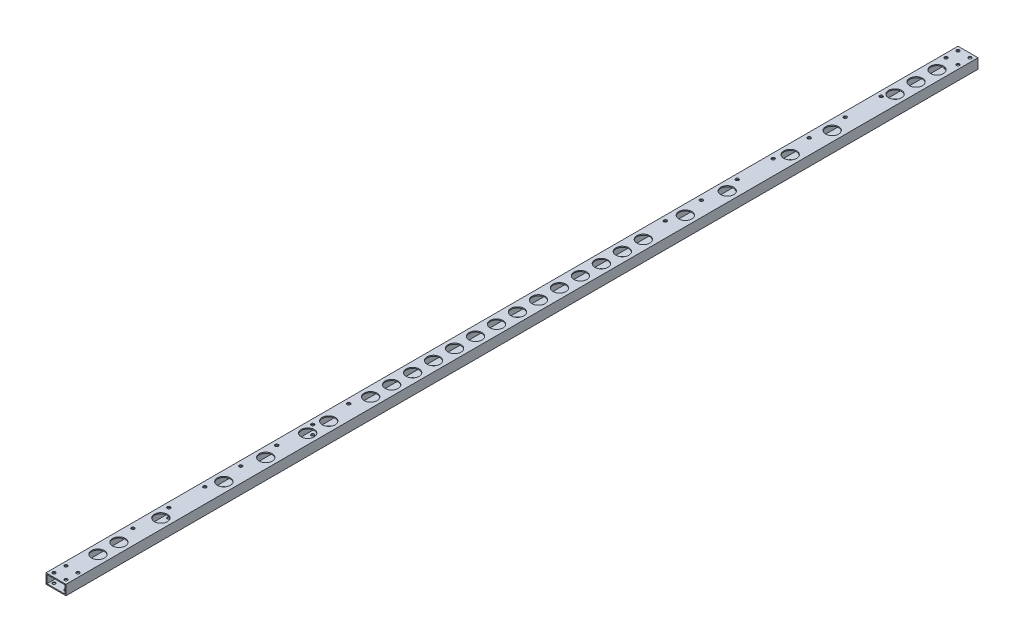
from build123d import *

# Parameters (mm, degrees)
SKETCH_1_W          = 20
SKETCH_1_H          = 10
SKETCH_1_W_2        = 18
SKETCH_1_H_2        = 8
EXTRUDE_1_DEPTH     = 913
SKETCH_2_R          = 1.6
CUT_EXTRUDE_1_DEPTH = 914.273781514
SKETCH_3_R          = 6.5
CUT_EXTRUDE_2_DEPTH = 914.273781514
SKETCH_4_R          = 1.575
CUT_EXTRUDE_3_DEPTH = 914.273781514


with BuildPart() as part:
    # 草图1 → 凸台-拉伸1 (new body)
    with BuildSketch(Plane.XY):
        with Locations((10, 5)):
            Rectangle(SKETCH_1_W, SKETCH_1_H)
        with Locations((10, 5)):
            Rectangle(SKETCH_1_W_2, SKETCH_1_H_2, mode=Mode.SUBTRACT)
    extrude(amount=EXTRUDE_1_DEPTH)

    # 草图2 → 切除-拉伸1 (cut, through all)
    with BuildSketch(Plane.XZ):
        with Locations(Location((5, 759, 0), (0, 0, 270))):
            Circle(SKETCH_2_R)
        with Locations(Location((5, 795, 0), (0, 0, 270))):
            Circle(SKETCH_2_R)
        with Locations(Location((5, 226, 0), (0, 0, 270))):
            Circle(SKETCH_2_R)
        with Locations(Location((5, 831, 0), (0, 0, 270))):
            Circle(SKETCH_2_R)
        with Locations(Location((5, 615, 0), (0, 0, 270))):
            Circle(SKETCH_2_R)
        with Locations(Location((5, 651, 0), (0, 0, 270))):
            Circle(SKETCH_2_R)
        with Locations(Location((5, 687, 0), (0, 0, 270))):
            Circle(SKETCH_2_R)
        with Locations(Location((5, 723, 0), (0, 0, 270))):
            Circle(SKETCH_2_R)
        with Locations(Location((5, 262, 0), (0, 0, 270))):
            Circle(SKETCH_2_R)
        with Locations(Location((5, 298, 0), (0, 0, 270))):
            Circle(SKETCH_2_R)
        with Locations(Location((5, 82, 0), (0, 0, 270))):
            Circle(SKETCH_2_R)
        with Locations(Location((5, 118, 0), (0, 0, 270))):
            Circle(SKETCH_2_R)
        with Locations(Location((5, 154, 0), (0, 0, 270))):
            Circle(SKETCH_2_R)
        with Locations(Location((5, 190, 0), (0, 0, 270))):
            Circle(SKETCH_2_R)
    extrude(amount=-CUT_EXTRUDE_1_DEPTH, mode=Mode.SUBTRACT)

    # 草图3 → 切除-拉伸2 (cut, through all)
    with BuildSketch(Plane(origin=(0, 10, 0), x_dir=(1, 0, 0), z_dir=(0, 1, 0))):
        with Locations(Location((10, -31, 0), (0, 0, 270))):
            Circle(SKETCH_3_R)
        with Locations(Location((10, -52, 0), (0, 0, 270))):
            Circle(SKETCH_3_R)
        with Locations(Location((10, -73, 0), (0, 0, 270))):
            Circle(SKETCH_3_R)
        with Locations(Location((10, -136, 0), (0, 0, 270))):
            Circle(SKETCH_3_R)
        with Locations(Location((10, -178, 0), (0, 0, 270))):
            Circle(SKETCH_3_R)
        with Locations(Location((10, -241, 0), (0, 0, 270))):
            Circle(SKETCH_3_R)
        with Locations(Location((10, -283, 0), (0, 0, 270))):
            Circle(SKETCH_3_R)
        with Locations(Location((10, -325, 0), (0, 0, 270))):
            Circle(SKETCH_3_R)
        with Locations(Location((10, -346, 0), (0, 0, 270))):
            Circle(SKETCH_3_R)
        with Locations(Location((10, -367, 0), (0, 0, 270))):
            Circle(SKETCH_3_R)
        with Locations(Location((10, -388, 0), (0, 0, 270))):
            Circle(SKETCH_3_R)
        with Locations(Location((10, -409, 0), (0, 0, 270))):
            Circle(SKETCH_3_R)
        with Locations(Location((10, -430, 0), (0, 0, 270))):
            Circle(SKETCH_3_R)
        with Locations(Location((10, -451, 0), (0, 0, 270))):
            Circle(SKETCH_3_R)
        with Locations(Location((10, -472, 0), (0, 0, 270))):
            Circle(SKETCH_3_R)
        with Locations(Location((10, -493, 0), (0, 0, 270))):
            Circle(SKETCH_3_R)
        with Locations(Location((10, -514, 0), (0, 0, 270))):
            Circle(SKETCH_3_R)
        with Locations(Location((10, -535, 0), (0, 0, 270))):
            Circle(SKETCH_3_R)
        with Locations(Location((10, -556, 0), (0, 0, 270))):
            Circle(SKETCH_3_R)
        with Locations(Location((10, -577, 0), (0, 0, 270))):
            Circle(SKETCH_3_R)
        with Locations(Location((10, -598, 0), (0, 0, 270))):
            Circle(SKETCH_3_R)
        with Locations(Location((10, -640, 0), (0, 0, 270))):
            Circle(SKETCH_3_R)
        with Locations(Location((10, -661, 0), (0, 0, 270))):
            Circle(SKETCH_3_R)
        with Locations(Location((10, -703, 0), (0, 0, 270))):
            Circle(SKETCH_3_R)
        with Locations(Location((10, -745, 0), (0, 0, 270))):
            Circle(SKETCH_3_R)
        with Locations(Location((10, -808, 0), (0, 0, 270))):
            Circle(SKETCH_3_R)
        with Locations(Location((10, -850, 0), (0, 0, 270))):
            Circle(SKETCH_3_R)
        with Locations(Location((10, -871, 0), (0, 0, 270))):
            Circle(SKETCH_3_R)
    extrude(amount=-CUT_EXTRUDE_2_DEPTH, mode=Mode.SUBTRACT)

    # 草图4 → 切除-拉伸3 (cut, through all)
    with BuildSketch(Plane(origin=(0, 10, 0), x_dir=(1, 0, 0), z_dir=(0, 1, 0))):
        with Locations(Location((16, -909, 0), (0, 0, 270))):
            Circle(SKETCH_4_R)
        with Locations(Location((4, -909, 0), (0, 0, 270))):
            Circle(SKETCH_4_R)
        with Locations(Location((4, -897, 0), (0, 0, 270))):
            Circle(SKETCH_4_R)
        with Locations(Location((16, -897, 0), (0, 0, 270))):
            Circle(SKETCH_4_R)
        with Locations(Location((16, -4, 0), (0, 0, 270))):
            Circle(SKETCH_4_R)
        with Locations(Location((4, -4, 0), (0, 0, 270))):
            Circle(SKETCH_4_R)
        with Locations(Location((4, -16, 0), (0, 0, 270))):
            Circle(SKETCH_4_R)
        with Locations(Location((16, -16, 0), (0, 0, 270))):
            Circle(SKETCH_4_R)
    extrude(amount=-CUT_EXTRUDE_3_DEPTH, mode=Mode.SUBTRACT)


solid = part.part
